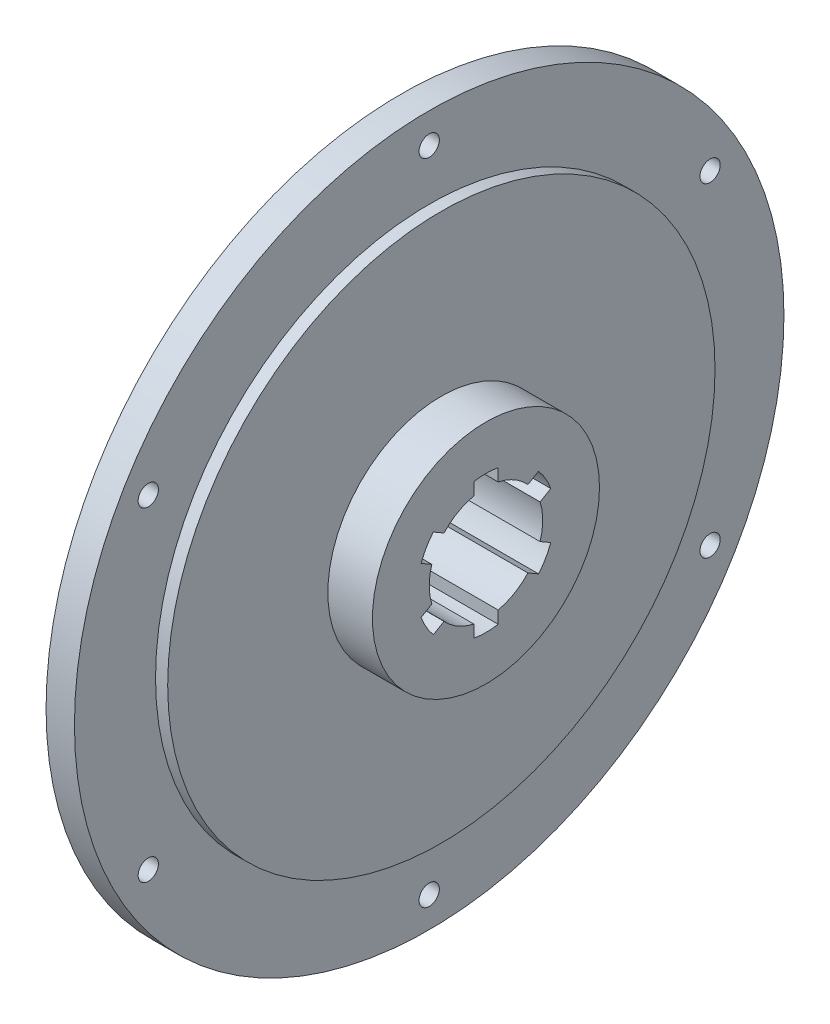
from build123d import *

# Parameters (mm, degrees)
SKETCH1_R           = 87.5
BOSS_EXTRUDE1_DEPTH = 7
SKETCH2_R           = 67.5
BOSS_EXTRUDE2_DEPTH = 3
SKETCH3_R           = 2.5
CUT_EXTRUDE1_DEPTH  = 124.941518467
SKETCH4_R           = 28
BOSS_EXTRUDE3_DEPTH = 11
BOSS_EXTRUDE4_START = 11
SKETCH6_R           = 28
BOSS_EXTRUDE4_DEPTH = 11
CUT_EXTRUDE2_DEPTH  = 128.814318447


with BuildPart() as part:
    # Sketch1 → Boss-Extrude1 (new body)
    with BuildSketch(Plane(origin=(0, 0, 0), x_dir=(0, 0, -1), z_dir=(1, 0, 0))):
        Circle(SKETCH1_R)
    extrude(amount=BOSS_EXTRUDE1_DEPTH)

    # Sketch2 → Boss-Extrude2 (add)
    with BuildSketch(Plane(origin=(7, 0, 0), x_dir=(0, 0, -1), z_dir=(1, 0, 0))):
        Circle(SKETCH2_R)
    extrude(amount=BOSS_EXTRUDE2_DEPTH)

    # Sketch3 → Cut-Extrude1 (cut, through all)
    with BuildSketch(Plane(origin=(7, 0, 0), x_dir=(0, 0, -1), z_dir=(1, 0, 0))):
        with Locations((0, -80)):
            Circle(SKETCH3_R)
        with Locations((-69.282032303, -40)):
            Circle(SKETCH3_R)
        with Locations((-69.282032303, 40)):
            Circle(SKETCH3_R)
        with Locations((0, 80)):
            Circle(SKETCH3_R)
        with Locations((69.282032303, 40)):
            Circle(SKETCH3_R)
        with Locations((69.282032303, -40)):
            Circle(SKETCH3_R)
    extrude(amount=-CUT_EXTRUDE1_DEPTH, mode=Mode.SUBTRACT)

    # Sketch4 → Boss-Extrude3 (add)
    with BuildSketch(Plane(origin=(10, 0, 0), x_dir=(0, 0, -1), z_dir=(1, 0, 0))):
        Circle(SKETCH4_R)
    extrude(amount=BOSS_EXTRUDE3_DEPTH)

    # Sketch6 → Boss-Extrude4 (add)
    with BuildSketch(Plane.ZY.offset(BOSS_EXTRUDE4_START)):
        with Locations(Location((0, 0, 0), (0, 0, 180))):
            Circle(SKETCH6_R)
    extrude(amount=-BOSS_EXTRUDE4_DEPTH)

    # Sketch8 → Cut-Extrude2 (cut, through all)
    with BuildSketch(Plane(origin=(21, 0, 0), x_dir=(0, 0, -1), z_dir=(1, 0, 0))):
        with BuildLine():
            Line((-3, 16.733200531), (-3, 13.674794331))
            ThreePointArc((-3, 13.674794331), (-7, 12.124355653), (-10.342719282, 9.435473377))
            Line((-10.342719282, 9.435473377), (-12.991376746, 10.964676477))
            ThreePointArc((-12.991376746, 10.964676477), (-14.722431864, 8.5), (-15.991376746, 5.768524054))
            Line((-15.991376746, 5.768524054), (-13.342719282, 4.239320954))
            ThreePointArc((-13.342719282, 4.239320954), (-14, 0), (-13.342719282, -4.239320954))
            Line((-13.342719282, -4.239320954), (-15.991376746, -5.768524054))
            ThreePointArc((-15.991376746, -5.768524054), (-14.722431864, -8.5), (-12.991376746, -10.964676477))
            Line((-12.991376746, -10.964676477), (-10.342719282, -9.435473377))
            ThreePointArc((-10.342719282, -9.435473377), (-7, -12.124355653), (-3, -13.674794331))
            Line((-3, -13.674794331), (-3, -16.733200531))
            ThreePointArc((-3, -16.733200531), (0, -17), (3, -16.733200531))
            Line((3, -16.733200531), (3, -13.674794331))
            ThreePointArc((3, -13.674794331), (7, -12.124355653), (10.342719282, -9.435473377))
            Line((10.342719282, -9.435473377), (12.991376746, -10.964676477))
            ThreePointArc((12.991376746, -10.964676477), (14.722431864, -8.5), (15.991376746, -5.768524054))
            Line((15.991376746, -5.768524054), (13.342719282, -4.239320954))
            ThreePointArc((13.342719282, -4.239320954), (14, 0), (13.342719282, 4.239320954))
            Line((13.342719282, 4.239320954), (15.991376746, 5.768524054))
            ThreePointArc((15.991376746, 5.768524054), (14.722431864, 8.5), (12.991376746, 10.964676477))
            Line((12.991376746, 10.964676477), (10.342719282, 9.435473377))
            ThreePointArc((10.342719282, 9.435473377), (7, 12.124355653), (3, 13.674794331))
            Line((3, 13.674794331), (3, 16.733200531))
            ThreePointArc((3, 16.733200531), (0, 17), (-3, 16.733200531))
        make_face()
    extrude(amount=-CUT_EXTRUDE2_DEPTH, mode=Mode.SUBTRACT)


solid = part.part
